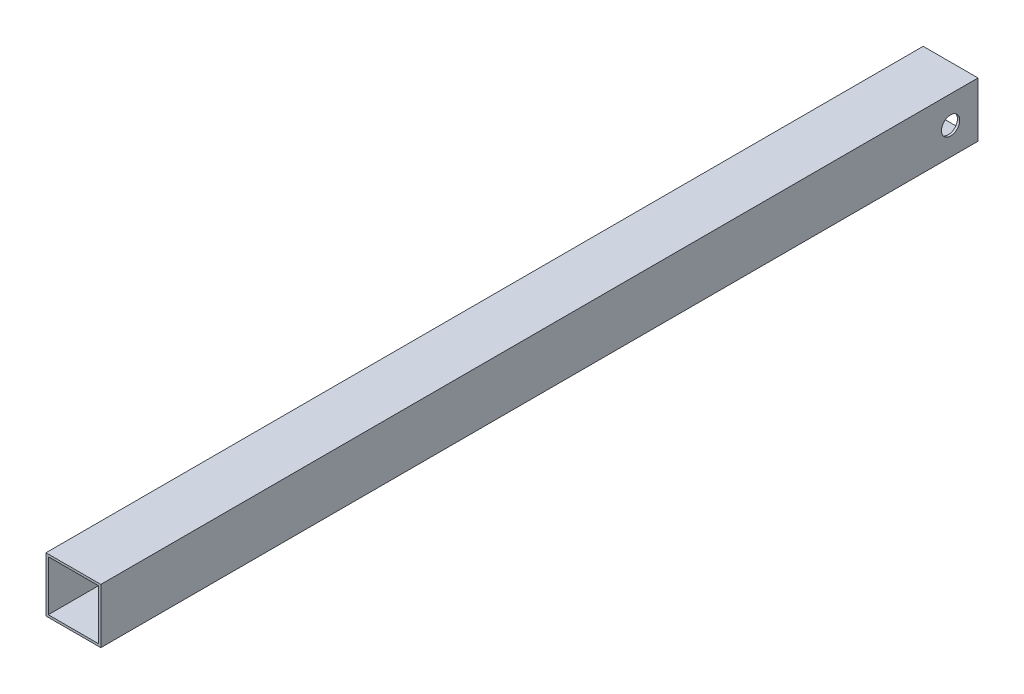
from build123d import *

# Parameters (mm, degrees)
SKETCH2_W                  = 38.1
SKETCH2_H                  = 38.1
SKETCH2_W_2                = 34.925
SKETCH2_H_2                = 34.925
BOSS_EXTRUDE1_DEPTH        = 609.6
F_1_2_0_5_DIAMETER_HOLE1_D = 12.7


with BuildPart() as part:
    # Sketch2 → Boss-Extrude1 (new body)
    with BuildSketch(Plane.XY):
        with Locations((19.05, 19.05)):
            Rectangle(SKETCH2_W, SKETCH2_H)
        with Locations((19.05, 19.05)):
            Rectangle(SKETCH2_W_2, SKETCH2_H_2, mode=Mode.SUBTRACT)
    extrude(amount=BOSS_EXTRUDE1_DEPTH)

    # 1/2 (0.5) Diameter Hole1 (through all)
    with Locations(Plane.ZY):
        with Locations((19.05, 19.05)):
            Hole(F_1_2_0_5_DIAMETER_HOLE1_D / 2)


solid = part.part
